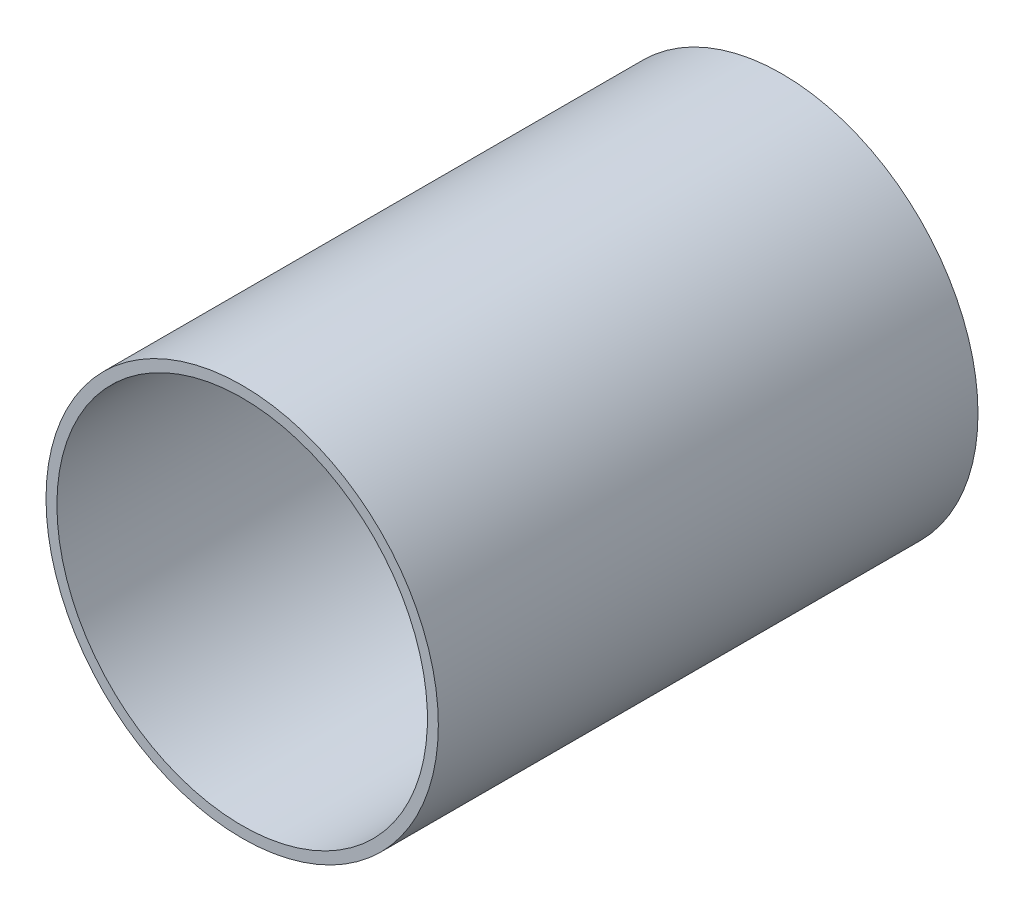
from build123d import *

# Parameters (mm, degrees)
BOSS_EXTRUDE1_DEPTH      = 152.4
BOSS_EXTRUDE1_DEPTH_BACK = 152.4
SKETCH3_R                = 57.15
SKETCH3_R_2              = 53.975
SKETCH5_R                = 72.477343224
CUT_EXTRUDE1_DEPTH       = 147.574


with BuildPart() as part:
    # Sketch3 → Boss-Extrude1 (new, two sides: drawn at the far end of the back side and taken through both)
    with BuildSketch(Plane.XY.offset(-BOSS_EXTRUDE1_DEPTH_BACK)):
        with Locations(Location((0, 0, 0), (0, 0, 180))):
            Circle(SKETCH3_R)
        with Locations(Location((0, 0, 0), (0, 0, 180))):
            Circle(SKETCH3_R_2, mode=Mode.SUBTRACT)
    extrude(amount=BOSS_EXTRUDE1_DEPTH + BOSS_EXTRUDE1_DEPTH_BACK)

    # Sketch5 → Cut-Extrude1 (cut)
    with BuildSketch(Plane.XY.offset(152.4)):
        Circle(SKETCH5_R)
    extrude(amount=-CUT_EXTRUDE1_DEPTH, mode=Mode.SUBTRACT)


solid = part.part
